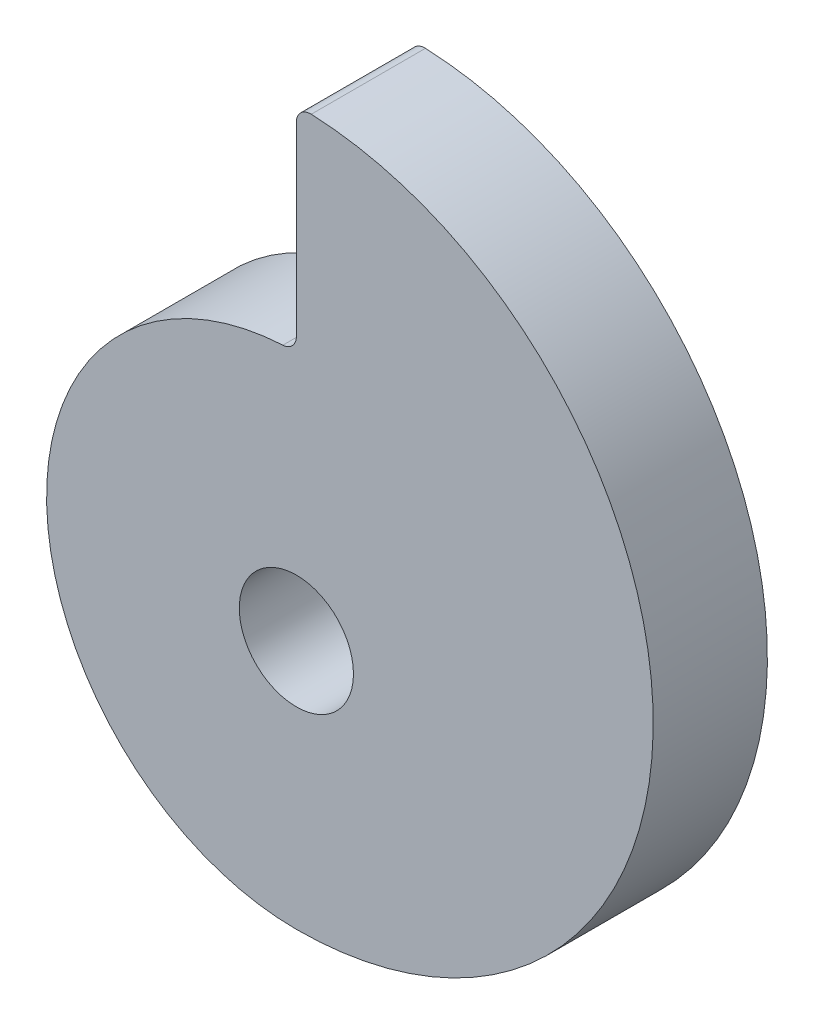
from build123d import *

# Parameters (mm, degrees)
SKETCH1_R           = 4
BOSS_EXTRUDE1_DEPTH = 8
FILLET1_R           = 1


with BuildPart() as part:
    # Sketch1 → Boss-Extrude1 (new body)
    with BuildSketch(Plane.XY):
        with BuildLine():
            Line((0, 10), (0, 25))
            ThreePointArc((0, 25), (25, 0), (0, -25))
            ThreePointArc((0, -25), (-17.5, -7.5), (0, 10))
        make_face()
        with Locations((0, -7.5)):
            Circle(SKETCH1_R, mode=Mode.SUBTRACT)
    extrude(amount=BOSS_EXTRUDE1_DEPTH)

    # Fillet1
    fillet1_edges = [part.edges().sort_by_distance(p)[0] for p in [
        (0, 10, 4),
        (0, 25, 4),
    ]]
    fillet(fillet1_edges, radius=FILLET1_R)


solid = part.part
